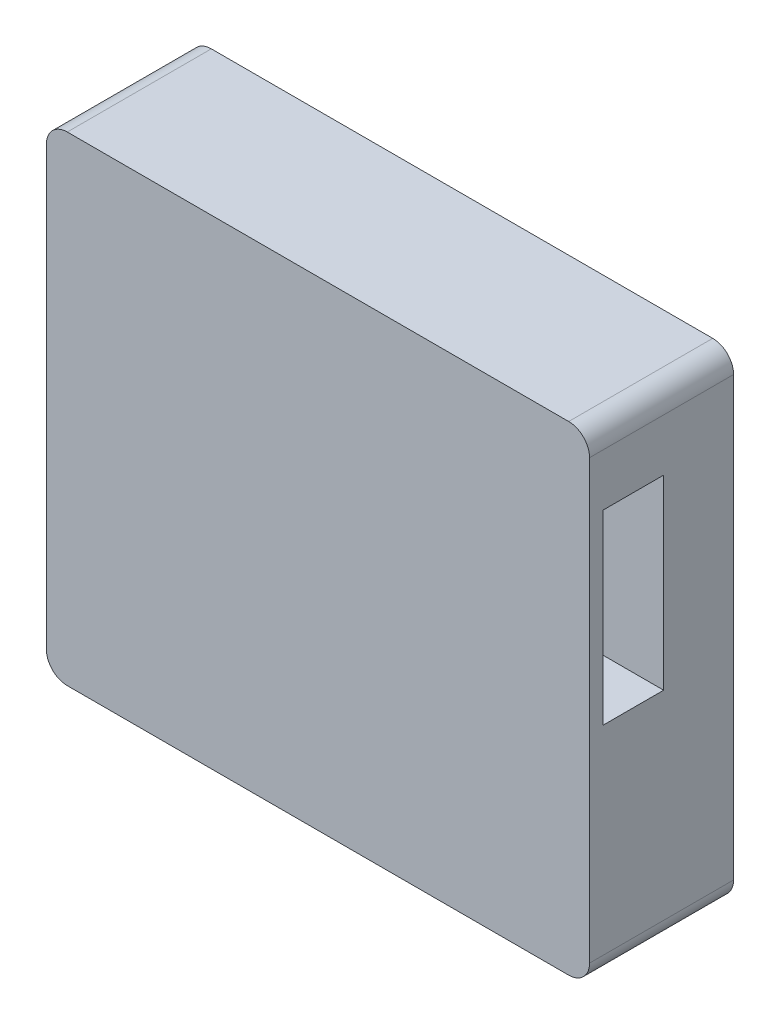
from build123d import *

# Parameters (mm, degrees)
BOSS_EXTRUDE2_DEPTH = 2
BOSS_EXTRUDE3_DEPTH = 28.266
SKETCH5_W           = 11.884268041
SKETCH5_H           = 36.556167698
CUT_EXTRUDE3_DEPTH  = 122.459124219
SKETCH7_W           = 8.89
SKETCH7_H           = 3.43
SKETCH7_W_2         = 14.05
SKETCH7_H_2         = 16.84
SKETCH7_W_3         = 17.696
SKETCH7_H_3         = 6.81
SKETCH7_W_4         = 9.3
SKETCH7_H_4         = 11
CUT_EXTRUDE4_DEPTH  = 32


with BuildPart() as part:
    # Sketch1 → Boss-Extrude2 (new body)
    with BuildSketch(Plane.XY):
        with BuildLine():
            Line((-14.4, -41.21), (84, -41.21))
            ThreePointArc((84, -41.21), (85.48492424, -40.59492424), (86.1, -39.11))
            Line((86.1, -39.11), (86.1, 46.79))
            ThreePointArc((86.1, 46.79), (85.48492424, 48.27492424), (84, 48.89))
            Line((84, 48.89), (-14.4, 48.89))
            ThreePointArc((-14.4, 48.89), (-15.88492424, 48.27492424), (-16.5, 46.79))
            Line((-16.5, 46.79), (-16.5, -39.11))
            ThreePointArc((-16.5, -39.11), (-15.88492424, -40.59492424), (-14.4, -41.21))
        make_face()
    extrude(amount=-BOSS_EXTRUDE2_DEPTH)

    # Sketch3 → Boss-Extrude3 (add)
    with BuildSketch(Plane.XY):
        with BuildLine():
            Line((-14.4, -43.21), (84, -43.21))
            ThreePointArc((84, -43.21), (86.899137803, -42.009137803), (88.1, -39.11))
            Line((88.1, -39.11), (88.1, 46.79))
            ThreePointArc((88.1, 46.79), (86.899137803, 49.689137803), (84, 50.89))
            Line((84, 50.89), (-14.4, 50.89))
            ThreePointArc((-14.4, 50.89), (-17.299137803, 49.689137803), (-18.5, 46.79))
            Line((-18.5, 46.79), (-18.5, -39.11))
            ThreePointArc((-18.5, -39.11), (-17.299137803, -42.009137803), (-14.4, -43.21))
        make_face()
    extrude(amount=-BOSS_EXTRUDE3_DEPTH)

    # Sketch5 → Cut-Extrude3 (cut, through all)
    with BuildSketch(Plane(origin=(88.1, 0, 0), x_dir=(0, 0, -1), z_dir=(1, 0, 0))):
        with Locations((8.594465961, 18.278083849)):
            Rectangle(SKETCH5_W, SKETCH5_H)
    extrude(amount=-CUT_EXTRUDE3_DEPTH, mode=Mode.SUBTRACT)

    # Sketch7 → Cut-Extrude4 (cut)
    with BuildSketch(Plane.XZ.offset(43.21)):
        with Locations((76.775, -26.5048)):
            Rectangle(SKETCH7_W, SKETCH7_H)
        Polygon((68.12, -28.296), (69.827, -28.296), (69.827, -14.646007205), (68.12, -14.646007205), (66.12, -14.646007205), (57.38, -14.646007205), (55.38, -14.646007205), (53.673, -14.646007205), (53.673, -28.296), (55.38, -28.296), (57.38, -28.296), (66.12, -28.296), align=None)
        with Locations((44.4, -19.7998)):
            Rectangle(SKETCH7_W_2, SKETCH7_H_2)
        with Locations((27.4, -19.7998)):
            Rectangle(SKETCH7_W_2, SKETCH7_H_2)
        with Locations((7.56, -24.8148)):
            Rectangle(SKETCH7_W_3, SKETCH7_H_3)
        with Locations((-9.2, -22.796)):
            Rectangle(SKETCH7_W_4, SKETCH7_H_4)
    extrude(amount=-CUT_EXTRUDE4_DEPTH, mode=Mode.SUBTRACT)


solid = part.part
